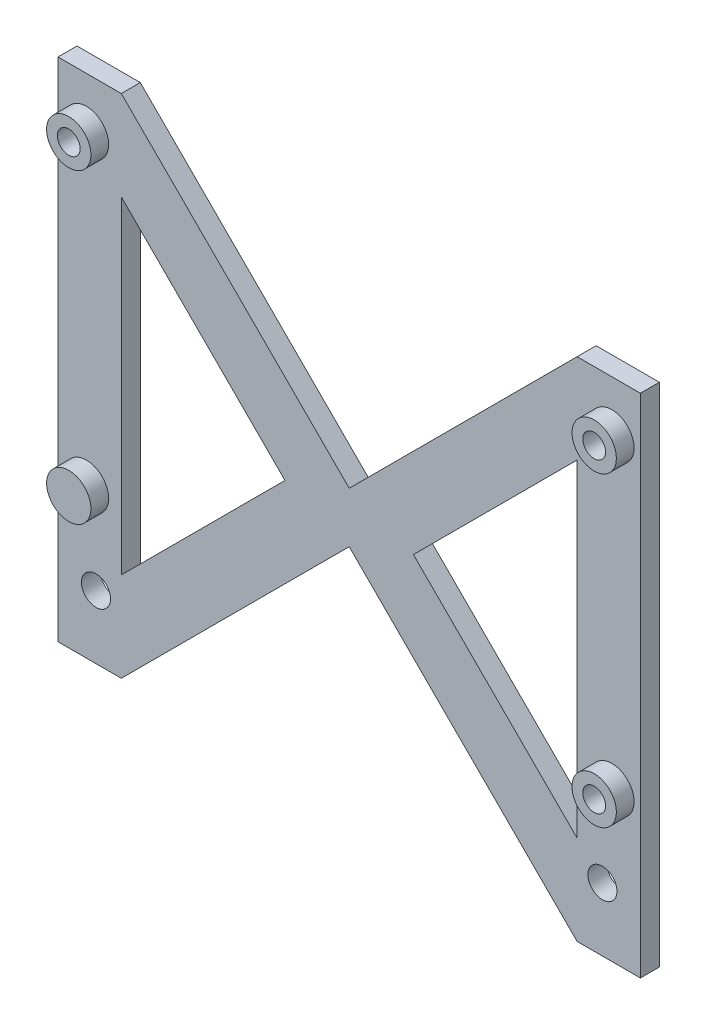
from build123d import *

# Parameters (mm, degrees)
SKETCH1_W           = 92
SKETCH1_H           = 80
BOSS_EXTRUDE1_DEPTH = 3
CUT_EXTRUDE1_DEPTH  = 62.032778079
SKETCH3_R           = 3.5
BOSS_EXTRUDE2_DEPTH = 2.8
SKETCH4_R           = 1.8
CUT_EXTRUDE2_DEPTH  = 62.234304111
SKETCH5_R           = 2.3
CUT_EXTRUDE3_DEPTH  = 62.032778079


with BuildPart() as part:
    # Sketch1 → Boss-Extrude1 (new body)
    with BuildSketch(Plane.XY):
        Rectangle(SKETCH1_W, SKETCH1_H)
    extrude(amount=BOSS_EXTRUDE1_DEPTH)

    # Sketch2 → Cut-Extrude1 (cut, through all)
    with BuildSketch(Plane.XY.offset(3)):
        Polygon((-36, 40), (0, 4), (36, 40), align=None)
        Polygon((-36, 25.857864376), (-36, -25.857864376), (-10.142135624, 0), align=None)
        Polygon((-36, -40), (0, -4), (36, -40), align=None)
        Polygon((36, 25.857864376), (36, -25.857864376), (10.142135624, 0), align=None)
    extrude(amount=-CUT_EXTRUDE1_DEPTH, mode=Mode.SUBTRACT)

    # Sketch3 → Boss-Extrude2 (add)
    with BuildSketch(Plane.XY.offset(3)):
        with Locations(Location((-41.5, 32, 0), (0, 0, 180))):
            Circle(SKETCH3_R)
        with Locations(Location((-41.5, -16.4, 0), (0, 0, 180))):
            Circle(SKETCH3_R)
        with Locations(Location((41.5, -16.4, 0), (0, 0, 180))):
            Circle(SKETCH3_R)
        with Locations(Location((41.5, 32, 0), (0, 0, 180))):
            Circle(SKETCH3_R)
    extrude(amount=BOSS_EXTRUDE2_DEPTH)

    # Sketch4 → Cut-Extrude2 (cut, through all)
    with BuildSketch(Plane.XY.offset(5.8)):
        with Locations((-41.5, 32)):
            Circle(SKETCH4_R)
        with Locations((41.5, 32)):
            Circle(SKETCH4_R)
        with Locations((41.5, -16.4)):
            Circle(SKETCH4_R)
    extrude(amount=-CUT_EXTRUDE2_DEPTH, mode=Mode.SUBTRACT)

    # Sketch5 → Cut-Extrude3 (cut, through all)
    with BuildSketch(Plane.XY.offset(3)):
        with Locations((-40, -30)):
            Circle(SKETCH5_R)
        with Locations((40, -30)):
            Circle(SKETCH5_R)
    extrude(amount=-CUT_EXTRUDE3_DEPTH, mode=Mode.SUBTRACT)


solid = part.part
